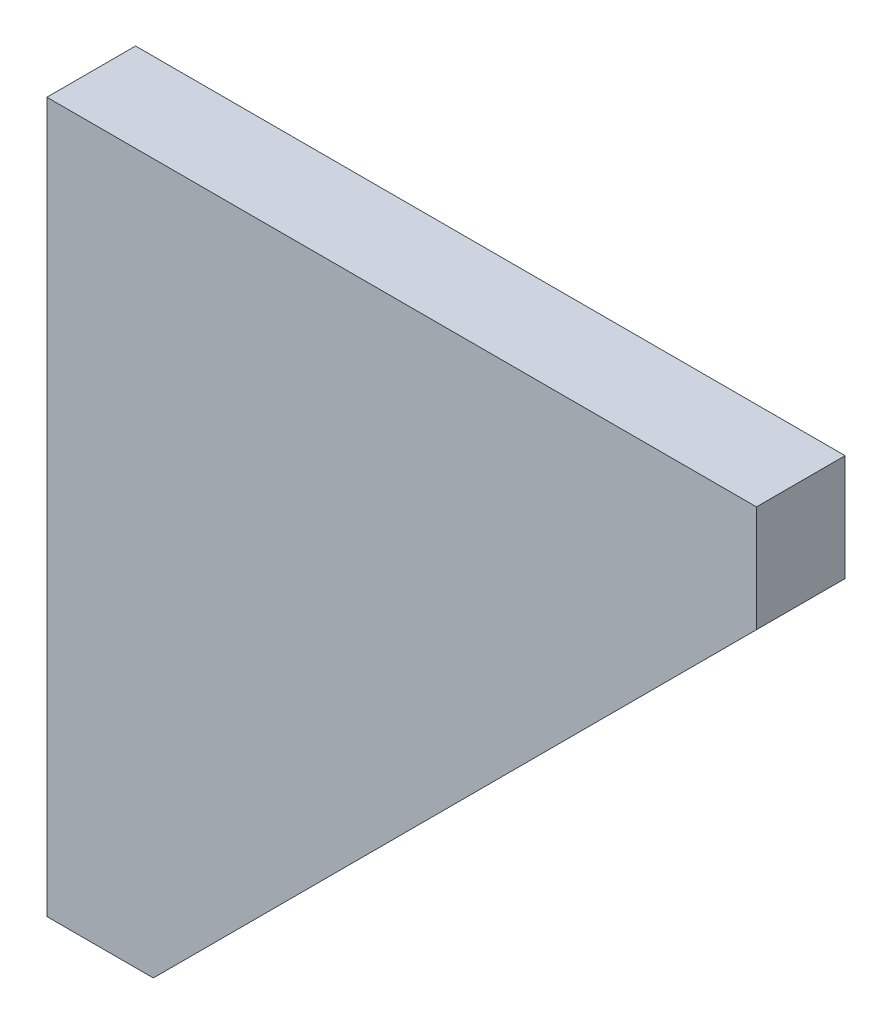
from build123d import *

# Parameters (mm, degrees)
DODANIE_WYCI_GNI_CIE1_DEPTH = 10


with BuildPart() as part:
    # Szkic1 → Dodanie-wyciągnięcie1 (new body)
    with BuildSketch(Plane.XY):
        Polygon((-12, -67), (-12, 13), (68, 13), (68, 1), (0, -67), align=None)
    extrude(amount=DODANIE_WYCI_GNI_CIE1_DEPTH)


solid = part.part
